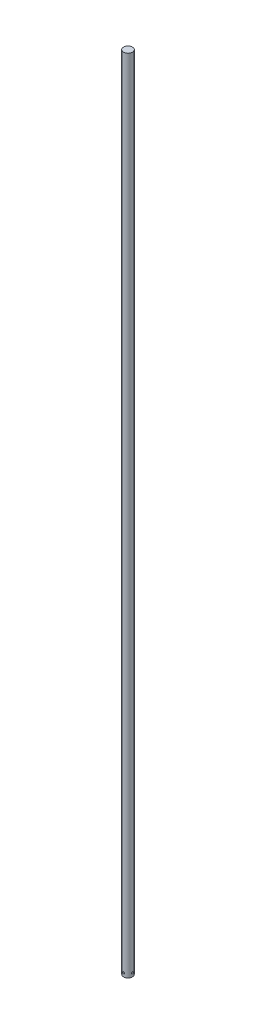
from build123d import *

# Parameters (mm, degrees)
SKETCH1_R           = 5
BOSS_EXTRUDE1_DEPTH = 900
SKETCH2_R           = 1
CUT_EXTRUDE1_DEPTH  = 900
CIRPATTERN1_COUNT   = 4


with BuildPart() as part:
    # Sketch1 → Boss-Extrude1 (new body)
    with BuildSketch(Plane(origin=(0, 0, 0), x_dir=(1, 0, 0), z_dir=(0, 1, 0))):
        with Locations(Location((0, 0, 0), (0, 0, 270))):
            Circle(SKETCH1_R)
    extrude(amount=BOSS_EXTRUDE1_DEPTH)

    # Sketch2 → Cut-Extrude1 (cut)
    with BuildSketch(Plane(origin=(0, 0, 0), x_dir=(0, 0, -1), z_dir=(1, 0, 0))):
        with Locations((0, 4)):
            Circle(SKETCH2_R)
    cut_extrude1 = extrude(amount=-CUT_EXTRUDE1_DEPTH, mode=Mode.SUBTRACT)

    # CirPattern1: Cut-Extrude1 ×4 about axis
    cirpattern1_axis = Axis((0, 0, 0), (0, 1, 0))
    for i in range(1, CIRPATTERN1_COUNT):
        add(cut_extrude1.rotate(cirpattern1_axis, i * 360 / CIRPATTERN1_COUNT), mode=Mode.SUBTRACT)


solid = part.part
